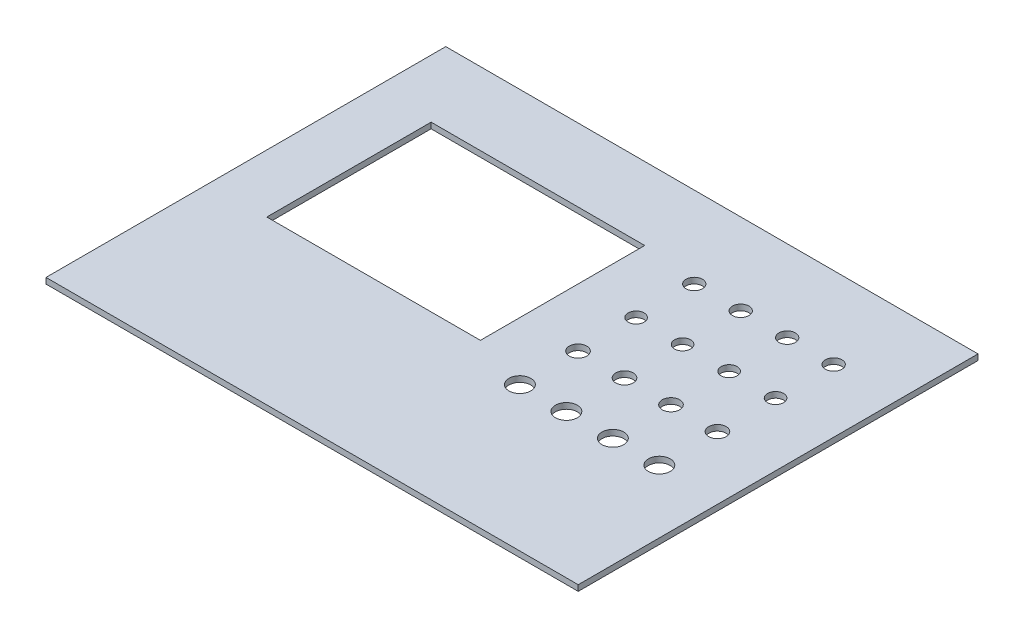
from build123d import *

# Parameters (mm, degrees)
SKETCH1_W           = 581.66
SKETCH1_H           = 436.88
BOSS_EXTRUDE1_DEPTH = 6.35
SKETCH3_W           = 233.426
SKETCH3_H           = 179.578
CUT_EXTRUDE2_DEPTH  = 728.483891574
SKETCH4_R           = 9.017
CUT_EXTRUDE3_DEPTH  = 728.483891574
SKETCH5_R           = 8.763
CUT_EXTRUDE4_DEPTH  = 728.483891574
SKETCH6_R           = 9.525
CUT_EXTRUDE5_DEPTH  = 728.483891574
SKETCH7_R           = 11.938
CUT_EXTRUDE6_DEPTH  = 728.483891574


with BuildPart() as part:
    # Sketch1 → Boss-Extrude1 (new body)
    with BuildSketch(Plane(origin=(0, 0, 0), x_dir=(1, 0, 0), z_dir=(0, 1, 0))):
        with Locations((290.83, 218.44)):
            Rectangle(SKETCH1_W, SKETCH1_H)
    extrude(amount=BOSS_EXTRUDE1_DEPTH)

    # Sketch3 → Cut-Extrude2 (cut, through all)
    with BuildSketch(Plane(origin=(0, 6.35, 0), x_dir=(1, 0, 0), z_dir=(0, 1, 0))):
        with Locations((180.213, 267.589)):
            Rectangle(SKETCH3_W, SKETCH3_H)
    extrude(amount=-CUT_EXTRUDE2_DEPTH, mode=Mode.SUBTRACT)

    # Sketch4 → Cut-Extrude3 (cut, through all)
    with BuildSketch(Plane(origin=(0, 6.35, 0), x_dir=(1, 0, 0), z_dir=(0, 1, 0))):
        with Locations(Location((360.426, 347.98, 0), (0, 0, 270))):
            Circle(SKETCH4_R)
        with Locations(Location((411.226, 347.98, 0), (0, 0, 270))):
            Circle(SKETCH4_R)
        with Locations(Location((462.026, 347.98, 0), (0, 0, 270))):
            Circle(SKETCH4_R)
        with Locations(Location((512.826, 347.98, 0), (0, 0, 270))):
            Circle(SKETCH4_R)
    extrude(amount=-CUT_EXTRUDE3_DEPTH, mode=Mode.SUBTRACT)

    # Sketch5 → Cut-Extrude4 (cut, through all)
    with BuildSketch(Plane(origin=(0, 6.35, 0), x_dir=(1, 0, 0), z_dir=(0, 1, 0))):
        with Locations(Location((360.426, 284.48, 0), (0, 0, 270))):
            Circle(SKETCH5_R)
        with Locations(Location((411.226, 284.48, 0), (0, 0, 270))):
            Circle(SKETCH5_R)
        with Locations(Location((462.026, 284.48, 0), (0, 0, 270))):
            Circle(SKETCH5_R)
        with Locations(Location((512.826, 284.48, 0), (0, 0, 270))):
            Circle(SKETCH5_R)
    extrude(amount=-CUT_EXTRUDE4_DEPTH, mode=Mode.SUBTRACT)

    # Sketch6 → Cut-Extrude5 (cut, through all)
    with BuildSketch(Plane(origin=(0, 6.35, 0), x_dir=(1, 0, 0), z_dir=(0, 1, 0))):
        with Locations(Location((360.426, 220.98, 0), (0, 0, 270))):
            Circle(SKETCH6_R)
        with Locations(Location((411.226, 220.98, 0), (0, 0, 270))):
            Circle(SKETCH6_R)
        with Locations(Location((462.026, 220.98, 0), (0, 0, 270))):
            Circle(SKETCH6_R)
        with Locations(Location((512.826, 220.98, 0), (0, 0, 270))):
            Circle(SKETCH6_R)
    extrude(amount=-CUT_EXTRUDE5_DEPTH, mode=Mode.SUBTRACT)

    # Sketch7 → Cut-Extrude6 (cut, through all)
    with BuildSketch(Plane(origin=(0, 6.35, 0), x_dir=(1, 0, 0), z_dir=(0, 1, 0))):
        with Locations(Location((360.426, 157.48, 0), (0, 0, 270))):
            Circle(SKETCH7_R)
        with Locations(Location((411.226, 157.48, 0), (0, 0, 270))):
            Circle(SKETCH7_R)
        with Locations(Location((462.026, 157.48, 0), (0, 0, 270))):
            Circle(SKETCH7_R)
        with Locations(Location((512.826, 157.48, 0), (0, 0, 270))):
            Circle(SKETCH7_R)
    extrude(amount=-CUT_EXTRUDE6_DEPTH, mode=Mode.SUBTRACT)


solid = part.part
